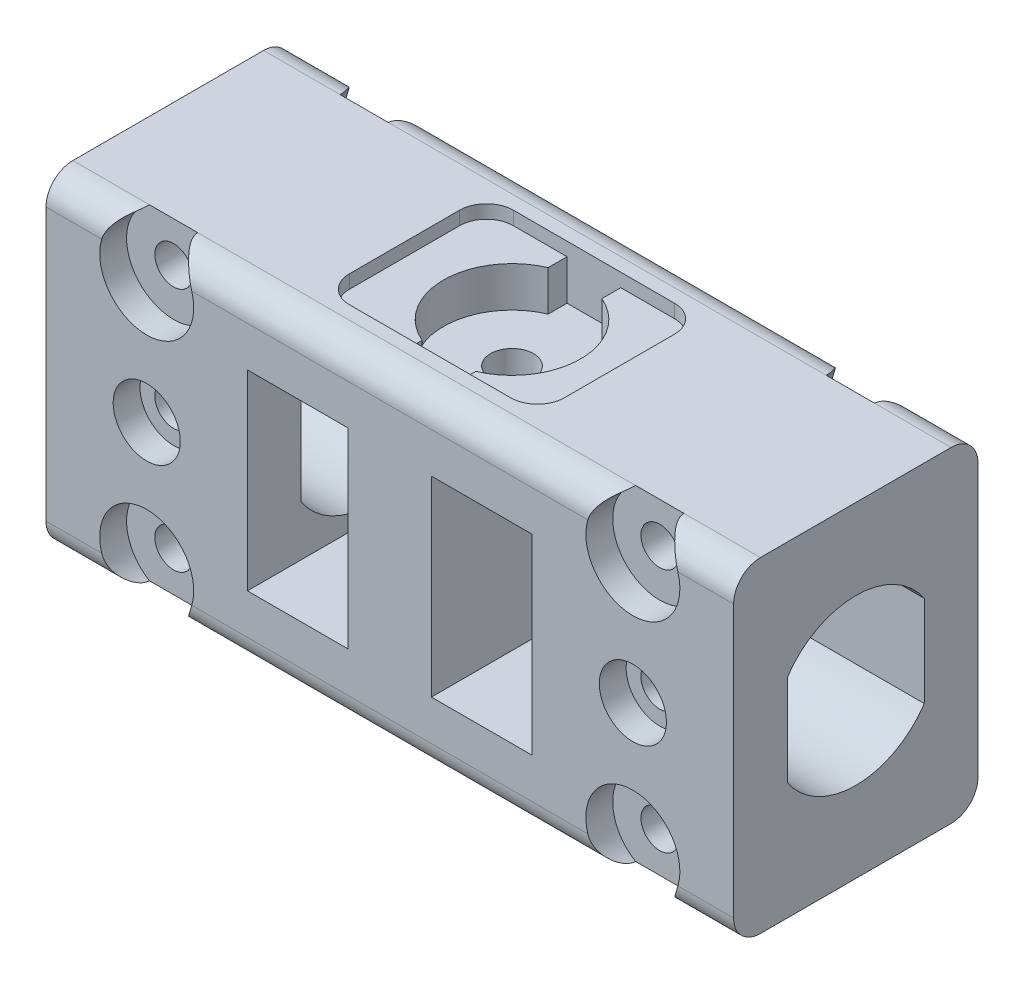
from build123d import *

# Parameters (mm, degrees)
CROQUIS1_W             = 24.25
CROQUIS1_H             = 18.2
BASE_ROTOR_1_DEPTH     = 15
CROQUIS2_W             = 14.25
CROQUIS2_H             = 3
BASE_ROTOR_2_DEPTH     = 7.5
CROQUIS3_W             = 3.1
CROQUIS3_H             = 24.25
BASE_ROTOR_3_DEPTH     = 18.2
CROQUIS4_R             = 1.4
PIN_JOIN_1_DEPTH       = 34.669208856
CROQUIS6_R             = 3.5
PIN_JOIN_2_DEPTH       = 2
PIN_JOIN_3_START       = -2
PIN_JOIN_3_DEPTH       = 2
CROQUIS9_R             = 1.4
PRISIONER_JOIN_1_DEPTH = 4
CROQUIS20_R            = 2.5
PRISIONER_JOIN_2_DEPTH = 2
BEARING_1_DEPTH        = 1
CROQUIS13_R            = 5.1
BEARING_2_DEPTH        = 3
CROQUIS22_W            = 4
CROQUIS22_H            = 1.408518358
BEARING_3_DEPTH        = 3
BEARING_4_START        = -1
BEARING_4_DEPTH        = 1
BEARING_5_START        = -3
BEARING_5_DEPTH        = 3
CROQUIS17_R            = 1.6
PIN_MAIN_DEPTH         = 56.80602566
FILLET_BOX_R           = 2


with BuildPart() as part:
    # Croquis1 → BASE_ROTOR_1 (new body)
    with BuildSketch(Plane.YZ):
        Rectangle(CROQUIS1_W, CROQUIS1_H)
        with BuildLine():
            Line((-3.391994251, 5.1), (3.391994251, 5.1))
            ThreePointArc((3.391994251, 5.1), (6.125, 0), (3.391994251, -5.1))
            Line((3.391994251, -5.1), (-3.391994251, -5.1))
            ThreePointArc((-3.391994251, -5.1), (-6.125, 0), (-3.391994251, 5.1))
        make_face(mode=Mode.SUBTRACT)
    extrude(amount=-BASE_ROTOR_1_DEPTH)

    # Croquis2 → BASE_ROTOR_2 (add)
    with BuildSketch(Plane(origin=(-15, 0, 0), x_dir=(0, -1, 0), z_dir=(-1, 0, 0))):
        Polygon((12.125, 9.1), (7.125, 9.1), (7.125, -6.1), (7.125, -9.1), (12.125, -9.1), align=None)
        with Locations((0, -7.6)):
            Rectangle(CROQUIS2_W, CROQUIS2_H)
        Polygon((-7.125, 9.1), (-12.125, 9.1), (-12.125, -9.1), (-7.125, -9.1), (-7.125, -6.1), align=None)
    extrude(amount=BASE_ROTOR_2_DEPTH)

    # Croquis3 → BASE_ROTOR_3 (add, through all)
    with BuildSketch(Plane(origin=(0, 0, -9.1), x_dir=(-1, 0, 0), z_dir=(0, 0, -1))):
        with Locations((24.05, 0)):
            Rectangle(CROQUIS3_W, CROQUIS3_H)
    extrude(amount=-BASE_ROTOR_3_DEPTH)

    # Croquis4 → PIN_JOIN_1 (cut, through all)
    with BuildSketch(Plane.XY.offset(9.1)):
        with Locations((-7.5, -9.125)):
            Circle(CROQUIS4_R)
        with Locations(Location((-7.5, 9.125, 0), (0, 0, 180))):
            Circle(CROQUIS4_R)
    extrude(amount=-PIN_JOIN_1_DEPTH, mode=Mode.SUBTRACT)

    # Croquis6 → PIN_JOIN_2 (cut)
    with BuildSketch(Plane(origin=(0, 0, -9.1), x_dir=(1, 0, 0), z_dir=(0, 0, -1))):
        with Locations((-7.5, 9.125)):
            Circle(CROQUIS6_R)
        with Locations((-7.5, -9.125)):
            Circle(CROQUIS6_R)
    extrude(amount=-PIN_JOIN_2_DEPTH, mode=Mode.SUBTRACT)

    # Croquis19 → PIN_JOIN_3 (cut)
    with BuildSketch(Plane.XY.offset(9.1).offset(PIN_JOIN_3_START)):
        with BuildLine():
            Line((-5.697224362, -12.125), (-9.302775638, -12.125))
            ThreePointArc((-9.302775638, -12.125), (-7.5, -5.625), (-5.697224362, -12.125))
        make_face()
        with BuildLine():
            Line((-9.302775638, 12.125), (-5.697224362, 12.125))
            ThreePointArc((-5.697224362, 12.125), (-7.5, 5.625), (-9.302775638, 12.125))
        make_face()
    extrude(amount=PIN_JOIN_3_DEPTH, mode=Mode.SUBTRACT)

    # Croquis9 → PRISIONER_JOIN_1 (cut)
    with BuildSketch(Plane.XY.offset(9.1)):
        with Locations((-7.5, 0)):
            Circle(CROQUIS9_R)
    extrude(amount=-PRISIONER_JOIN_1_DEPTH, mode=Mode.SUBTRACT)

    # Croquis20 → PRISIONER_JOIN_2 (cut)
    with BuildSketch(Plane.XY.offset(9.1)):
        with Locations((-7.5, 0)):
            Circle(CROQUIS20_R)
    extrude(amount=-PRISIONER_JOIN_2_DEPTH, mode=Mode.SUBTRACT)

    # Simetría1: part across plane


with BuildPart() as part_1:
    add(part.part)
    add(part.part.mirror(Plane(origin=(-25.6, 12.125, 9.1), x_dir=(0, 0, 1), z_dir=(-1, 0, 0))))

    # Croquis11 → BEARING_1 (cut)
    with BuildSketch(Plane(origin=(0, 12.125, 0), x_dir=(-1, 0, 0), z_dir=(0, 1, 0))):
        with BuildLine():
            Line((19.6, 6.1), (31.6, 6.1))
            ThreePointArc((31.6, 6.1), (33.014213562, 5.514213562), (33.6, 4.1))
            Line((33.6, 4.1), (33.6, -4.1))
            ThreePointArc((33.6, -4.1), (33.014213562, -5.514213562), (31.6, -6.1))
            Line((31.6, -6.1), (19.6, -6.1))
            ThreePointArc((19.6, -6.1), (18.185786438, -5.514213562), (17.6, -4.1))
            Line((17.6, -4.1), (17.6, 4.1))
            ThreePointArc((17.6, 4.1), (18.185786438, 5.514213562), (19.6, 6.1))
        make_face()
    extrude(amount=-BEARING_1_DEPTH, mode=Mode.SUBTRACT)

    # Croquis13 → BEARING_2 (cut)
    with BuildSketch(Plane(origin=(0, 11.125, 0), x_dir=(-1, 0, 0), z_dir=(0, 1, 0))):
        with Locations(Location((25.6, 0, 0), (0, 0, 90))):
            Circle(CROQUIS13_R)
    extrude(amount=-BEARING_2_DEPTH, mode=Mode.SUBTRACT)

    # Croquis22 → BEARING_3 (cut)
    with BuildSketch(Plane(origin=(0, 11.125, 0), x_dir=(-1, 0, 0), z_dir=(0, 1, 0))):
        with Locations((25.6, -5.395740821)):
            Rectangle(CROQUIS22_W, CROQUIS22_H)
        with Locations((25.6, 5.395740821)):
            Rectangle(CROQUIS22_W, CROQUIS22_H)
    extrude(amount=-BEARING_3_DEPTH, mode=Mode.SUBTRACT)

    # Croquis15 → BEARING_4 (cut)
    with BuildSketch(Plane.XZ.offset(12.125).offset(BEARING_4_START)):
        with BuildLine():
            Line((-17.6, 4.1), (-17.6, -4.1))
            ThreePointArc((-17.6, -4.1), (-18.185786438, -5.514213562), (-19.6, -6.1))
            Line((-19.6, -6.1), (-31.6, -6.1))
            ThreePointArc((-31.6, -6.1), (-33.014213562, -5.514213562), (-33.6, -4.1))
            Line((-33.6, -4.1), (-33.6, 4.1))
            ThreePointArc((-33.6, 4.1), (-33.014213562, 5.514213562), (-31.6, 6.1))
            Line((-31.6, 6.1), (-19.6, 6.1))
            ThreePointArc((-19.6, 6.1), (-18.185786438, 5.514213562), (-17.6, 4.1))
        make_face()
    extrude(amount=BEARING_4_DEPTH, mode=Mode.SUBTRACT)

    # Croquis16 → BEARING_5 (cut)
    with BuildSketch(Plane.XZ.offset(11.125).offset(BEARING_5_START)):
        with BuildLine():
            Line((-23.6, -6.1), (-23.6, -4.691481642))
            ThreePointArc((-23.6, -4.691481642), (-20.5, 0), (-23.6, 4.691481642))
            Line((-23.6, 4.691481642), (-23.6, 6.1))
            Line((-23.6, 6.1), (-27.6, 6.1))
            Line((-27.6, 6.1), (-27.6, 4.691481642))
            ThreePointArc((-27.6, 4.691481642), (-30.7, 0), (-27.6, -4.691481642))
            Line((-27.6, -4.691481642), (-27.6, -6.1))
            Line((-27.6, -6.1), (-23.6, -6.1))
        make_face()
    extrude(amount=BEARING_5_DEPTH, mode=Mode.SUBTRACT)

    # Croquis17 → PIN_MAIN (cut, through all)
    with BuildSketch(Plane(origin=(0, 8.125, 0), x_dir=(-1, 0, 0), z_dir=(0, 1, 0))):
        with Locations(Location((25.6, 0, 0), (0, 0, 90))):
            Circle(CROQUIS17_R)
    extrude(amount=-PIN_MAIN_DEPTH, mode=Mode.SUBTRACT)

    # FILLET_BOX
    fillet_box_edges = [part_1.edges().sort_by_distance(p)[0] for p in [
        (-25.6, 12.125, -9.1),
        (-48.351387819, 12.125, -9.1),
        (-48.351387819, 12.125, 9.1),
        (-25.6, 12.125, 9.1),
        (-2.848612181, 12.125, 9.1),
        (-2.848612181, -12.125, -9.1),
        (-25.6, -12.125, -9.1),
        (-48.351387819, -12.125, -9.1),
        (-48.351387819, -12.125, 9.1),
        (-2.848612181, -12.125, 9.1),
        (-25.6, -12.125, 9.1),
        (-2.848612181, 12.125, -9.1),
    ]]
    fillet(fillet_box_edges, radius=FILLET_BOX_R)


solid = part_1.part
